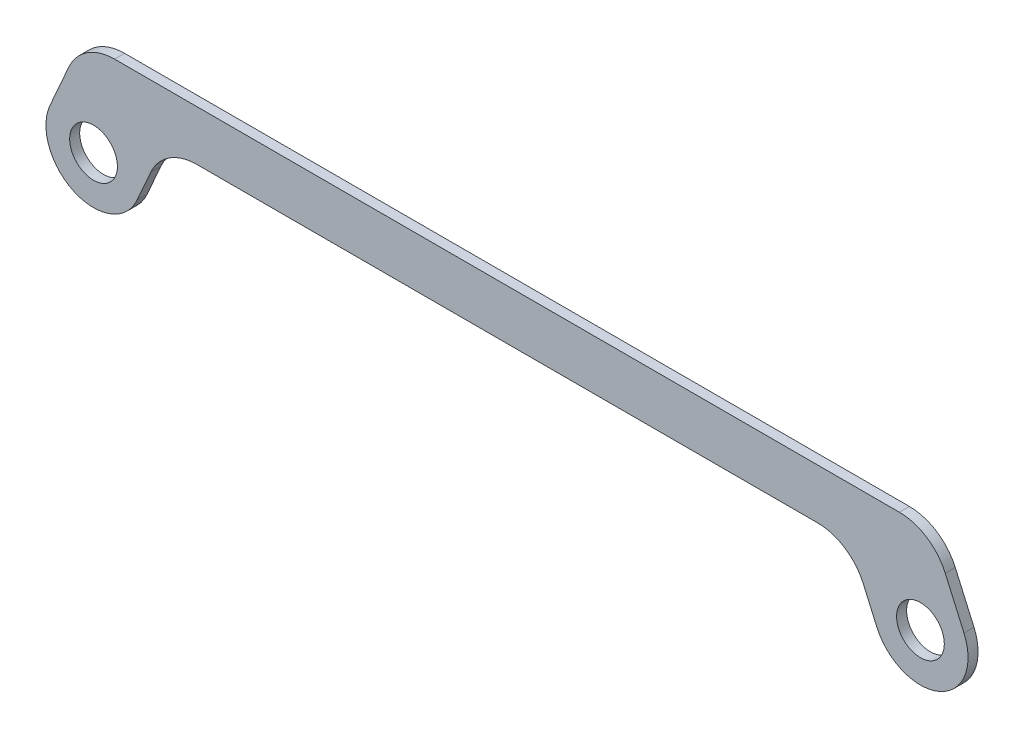
from build123d import *

# Parameters (mm, degrees)
SKETCH_1_R      = 9.525
EXTRUDE_1_DEPTH = 4
FILLET_1_R      = 20


with BuildPart() as part:
    # 草图1 → 凸台-拉伸1 (new body)
    with BuildSketch(Plane.XY):
        with BuildLine():
            Line((-4.63962822, 36.550100793), (334.63962822, 36.550100793))
            Line((334.63962822, 36.550100793), (347.382944688, 7.670282522))
            ThreePointArc((347.382944688, 7.670282522), (337.670282522, -17.382944688), (312.617055312, -7.670282522))
            Line((312.617055312, -7.670282522), (301.929730112, 16.550100793))
            Line((301.929730112, 16.550100793), (28.070269888, 16.550100793))
            Line((28.070269888, 16.550100793), (17.382944688, -7.670282522))
            ThreePointArc((17.382944688, -7.670282522), (-7.670282522, -17.382944688), (-17.382944688, 7.670282522))
            Line((-17.382944688, 7.670282522), (-4.63962822, 36.550100793))
        make_face()
        Circle(SKETCH_1_R, mode=Mode.SUBTRACT)
        with Locations((330, 0)):
            Circle(SKETCH_1_R, mode=Mode.SUBTRACT)
    extrude(amount=EXTRUDE_1_DEPTH)

    # 圆角1
    fillet_1_edges = [part.edges().sort_by_distance(p)[0] for p in [
        (-4.63962822, 36.550100793, 2),
        (334.63962822, 36.550100793, 2),
        (301.929730112, 16.550100793, 2),
        (28.070269888, 16.550100793, 2),
    ]]
    fillet(fillet_1_edges, radius=FILLET_1_R)


solid = part.part
